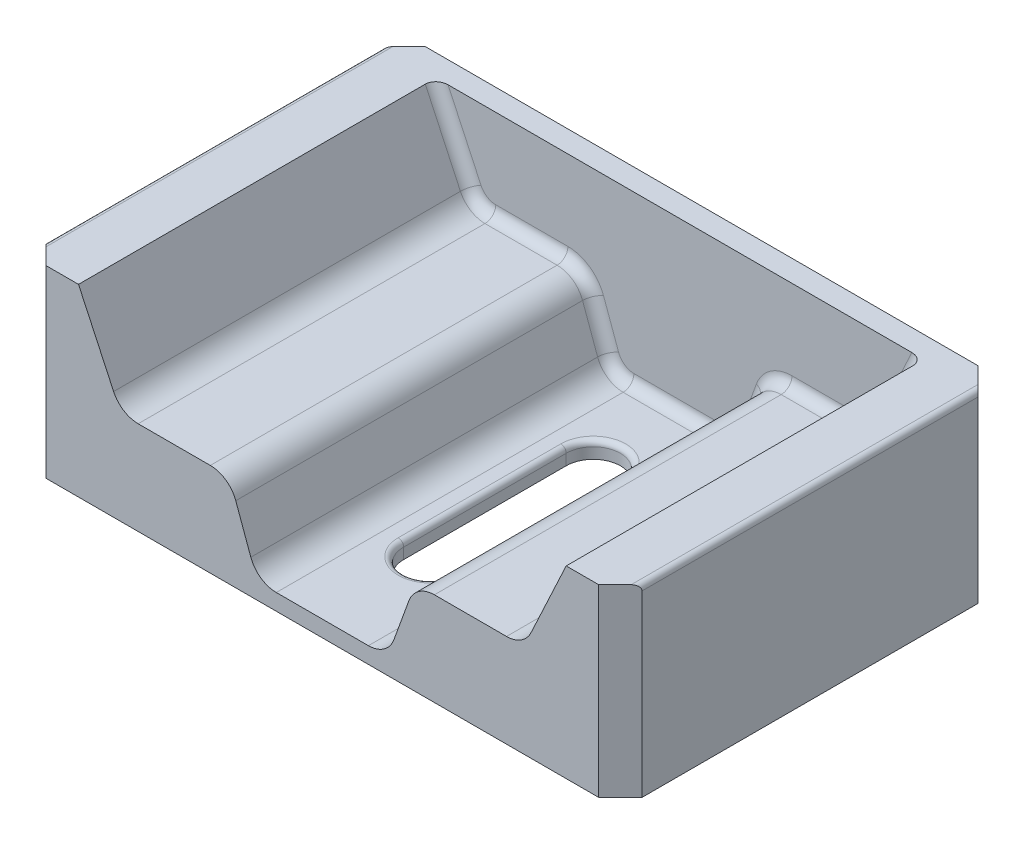
from build123d import *

# Parameters (mm, degrees)
SKETCH3_W           = 139.7
SKETCH3_H           = 88.9
BOSS_EXTRUDE2_DEPTH = 43.18
CUT_EXTRUDE1_DEPTH  = 83.82
CUT_EXTRUDE2_DEPTH  = 94.377392339
CHAMFER1_SIZE       = 5.08
FILLET1_R           = 1.27
FILLET2_R           = 6.35
FILLET3_R           = 2.54
FILLET4_R           = 1.27


with BuildPart() as part:
    # Sketch3 → Boss-Extrude2 (new body)
    with BuildSketch(Plane(origin=(0, 0, 0), x_dir=(1, 0, 0), z_dir=(0, 1, 0))):
        Rectangle(SKETCH3_W, SKETCH3_H)
    extrude(amount=BOSS_EXTRUDE2_DEPTH)

    # Sketch4 → Cut-Extrude1 (cut)
    with BuildSketch(Plane.XY.offset(44.45)):
        Polygon((-57.15, 43.18), (57.15, 43.18), (47.214435647, 21.873113486), (21.814435647, 21.873113486), (15.24, 3.81), (-15.24, 3.81), (-21.814435647, 21.873113486), (-47.214435647, 21.873113486), align=None)
    extrude(amount=-CUT_EXTRUDE1_DEPTH, mode=Mode.SUBTRACT)

    # Sketch6 → Cut-Extrude2 (cut, through all)
    with BuildSketch(Plane(origin=(0, 43.18, 0), x_dir=(1, 0, 0), z_dir=(0, 1, 0))):
        with BuildLine():
            Line((-6.35, -19.05), (-6.35, 19.05))
            ThreePointArc((-6.35, 19.05), (0, 25.4), (6.35, 19.05))
            Line((6.35, 19.05), (6.35, -19.05))
            ThreePointArc((6.35, -19.05), (0, -25.4), (-6.35, -19.05))
        make_face()
    extrude(amount=-CUT_EXTRUDE2_DEPTH, mode=Mode.SUBTRACT)

    # Chamfer1
    chamfer1_edges = [part.edges().sort_by_distance(p)[0] for p in [
        (69.85, 21.59, 44.45),
        (-69.85, 21.59, 44.45),
        (-69.85, 21.59, -44.45),
        (69.85, 21.59, -44.45),
    ]]
    chamfer(chamfer1_edges, length=CHAMFER1_SIZE)

    # Fillet1
    fillet1_edges = [part.edges().sort_by_distance(p)[0] for p in [
        (-69.85, 43.18, 0),
        (69.85, 43.18, 0),
    ]]
    fillet(fillet1_edges, radius=FILLET1_R)

    # Fillet2
    fillet2_edges = [part.edges().sort_by_distance(p)[0] for p in [
        (-47.214435647, 21.873113486, 2.54),
        (47.214435647, 21.873113486, 2.54),
        (21.814435647, 21.873113486, 2.54),
        (15.24, 3.81, 2.54),
        (-15.24, 3.81, 2.54),
        (-21.814435647, 21.873113486, 2.54),
    ]]
    fillet(fillet2_edges, radius=FILLET2_R)

    # Fillet3
    fillet3_edges = [part.edges().sort_by_distance(p)[0] for p in [
        (53.037046969, 34.359743762, -39.37),
        (34.714896503, 21.873113486, -39.37),
        (-34.714896503, 21.873113486, -39.37),
        (-18.527217824, 12.841556743, -39.37),
        (0, 3.81, -39.37),
        (18.527217824, 12.841556743, -39.37),
        (-46.580892004, 22.867577805, -39.37),
        (-14.435892503, 4.958384519, -39.37),
        (14.435892503, 4.958384519, -39.37),
        (46.580892004, 22.867577805, -39.37),
        (22.618543144, 20.724728967, -39.37),
        (-22.618543144, 20.724728967, -39.37),
        (-53.037046969, 34.359743762, -39.37),
    ]]
    fillet(fillet3_edges, radius=FILLET3_R)

    # Fillet4
    fillet4_edges = [part.edges().sort_by_distance(p)[0] for p in [
        (6.35, 3.81, 0),
        (0, 3.81, -25.4),
        (-6.35, 3.81, 0),
        (0, 3.81, 25.4),
    ]]
    fillet(fillet4_edges, radius=FILLET4_R)


solid = part.part
